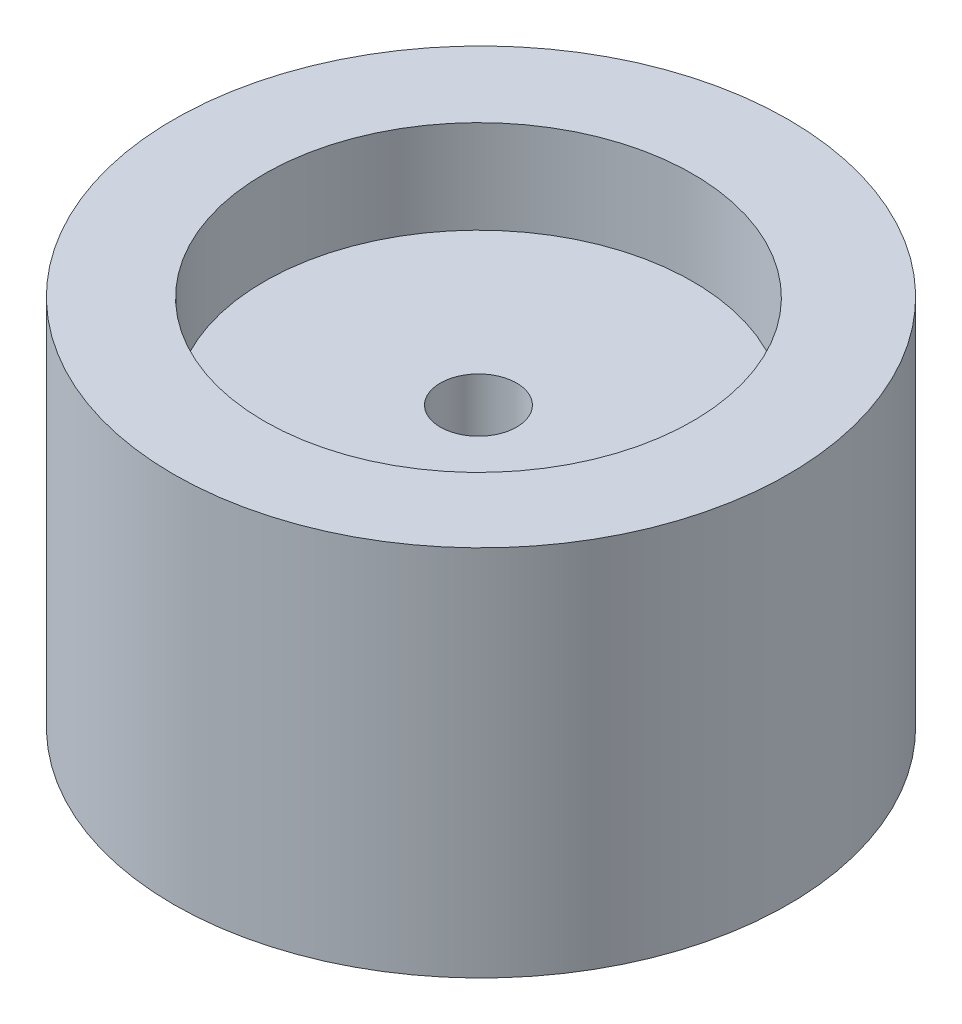
from build123d import *

# Parameters (mm, degrees)
SKETCH1_R           = 16.5
BOSS_EXTRUDE1_DEPTH = 20
SKETCH2_R           = 2.05
CUT_EXTRUDE1_DEPTH  = 51.659211704
SKETCH9_R           = 11.5
CUT_EXTRUDE2_DEPTH  = 5


with BuildPart() as part:
    # Sketch1 → Boss-Extrude1 (new body)
    with BuildSketch(Plane(origin=(0, 0, 0), x_dir=(1, 0, 0), z_dir=(0, 1, 0))):
        with Locations(Location((-11.073338277, 20.997556543, 0), (0, 0, 270))):
            Circle(SKETCH1_R)
    extrude(amount=BOSS_EXTRUDE1_DEPTH)

    # Sketch2 → Cut-Extrude1 (cut, through all)
    with BuildSketch(Plane(origin=(0, 20, 0), x_dir=(1, 0, 0), z_dir=(0, 1, 0))):
        with Locations(Location((-11.112077012, 20.900709706, 0), (0, 0, 270))):
            Circle(SKETCH2_R)
    extrude(amount=-CUT_EXTRUDE1_DEPTH, mode=Mode.SUBTRACT)

    # Sketch9 → Cut-Extrude2 (cut)
    with BuildSketch(Plane(origin=(0, 20, 0), x_dir=(1, 0, 0), z_dir=(0, 1, 0))):
        with Locations(Location((-11.112077012, 20.900709706, 0), (0, 0, 270))):
            Circle(SKETCH9_R)
    extrude(amount=-CUT_EXTRUDE2_DEPTH, mode=Mode.SUBTRACT)


solid = part.part
